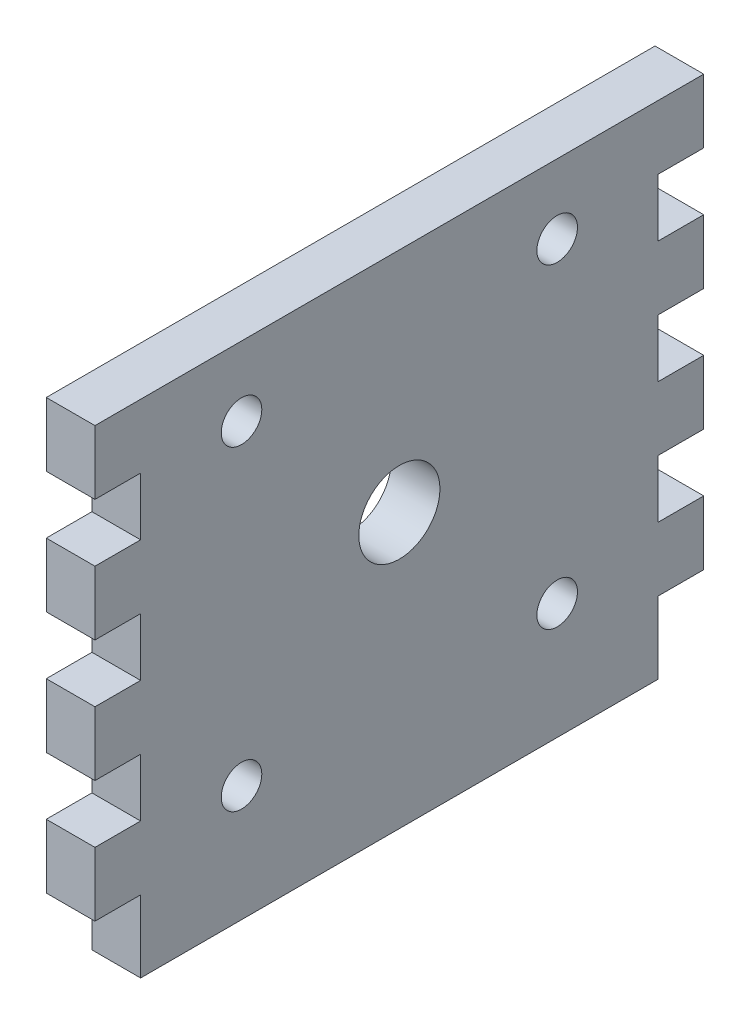
from build123d import *

# Parameters (mm, degrees)
SKETCH1_W               = 76.2
SKETCH1_H               = 62.738
BOSS_EXTRUDE1_DEPTH     = 6.096
SKETCH2_R               = 5.08
SKETCH2_R_2             = 2.54
CUT_EXTRUDE1_DEPTH      = 6.096
SKETCH3_W               = 5.715
SKETCH3_H               = 7.239
CUT_EXTRUDE2_DEPTH      = 6.096
CUT_EXTRUDE3_DEPTH      = 7.874
CUT_EXTRUDE3_DEPTH_BACK = 6.096
SKETCH4_W               = 5.715
SKETCH4_H               = 9.017


with BuildPart() as part:
    # Sketch1 → Boss-Extrude1 (new body)
    with BuildSketch(Plane(origin=(0, 0, 0), x_dir=(0, 0, -1), z_dir=(1, 0, 0))):
        with Locations((1.357482185, -4.852847981)):
            Rectangle(SKETCH1_W, SKETCH1_H)
    extrude(amount=BOSS_EXTRUDE1_DEPTH)

    # Sketch2 → Cut-Extrude1 (cut)
    with BuildSketch(Plane(origin=(6.096, 0, 0), x_dir=(0, 0, -1), z_dir=(1, 0, 0))):
        with Locations((1.357482185, -1.931847981)):
            Circle(SKETCH2_R)
        with Locations((-18.399081281, 17.824715485)):
            Circle(SKETCH2_R_2)
        with Locations((21.114045652, 17.824715485)):
            Circle(SKETCH2_R_2)
        with Locations((21.114045652, -21.688411447)):
            Circle(SKETCH2_R_2)
        with Locations((-18.399081281, -21.688411447)):
            Circle(SKETCH2_R_2)
    extrude(amount=-CUT_EXTRUDE1_DEPTH, mode=Mode.SUBTRACT)

    # Sketch3 → Cut-Extrude2 (cut)
    with BuildSketch(Plane(origin=(6.096, 0, 0), x_dir=(0, 0, -1), z_dir=(1, 0, 0))):
        with Locations((-33.885017815, 14.895652019)):
            Rectangle(SKETCH3_W, SKETCH3_H)
        with Locations((-33.885017815, -0.344347981)):
            Rectangle(SKETCH3_W, SKETCH3_H)
        with Locations((-33.885017815, -15.584347981)):
            Rectangle(SKETCH3_W, SKETCH3_H)
        with Locations((36.599982185, -15.584347981)):
            Rectangle(SKETCH3_W, SKETCH3_H)
        with Locations((36.599982185, 14.895652019)):
            Rectangle(SKETCH3_W, SKETCH3_H)
        with Locations((36.599982185, -0.344347981)):
            Rectangle(SKETCH3_W, SKETCH3_H)
    extrude(amount=-CUT_EXTRUDE2_DEPTH, mode=Mode.SUBTRACT)

    # Sketch4 → Cut-Extrude3 (cut, two sides: drawn at the far end of the back side and taken through both)
    with BuildSketch(Plane(origin=(6.096, 0, 0), x_dir=(0, 0, -1), z_dir=(1, 0, 0)).offset(-CUT_EXTRUDE3_DEPTH_BACK)):
        with Locations((36.599982185, -31.713347981)):
            Rectangle(SKETCH4_W, SKETCH4_H)
        with Locations((-33.885017815, -31.713347981)):
            Rectangle(SKETCH4_W, SKETCH4_H)
    extrude(amount=CUT_EXTRUDE3_DEPTH + CUT_EXTRUDE3_DEPTH_BACK, mode=Mode.SUBTRACT)


solid = part.part
